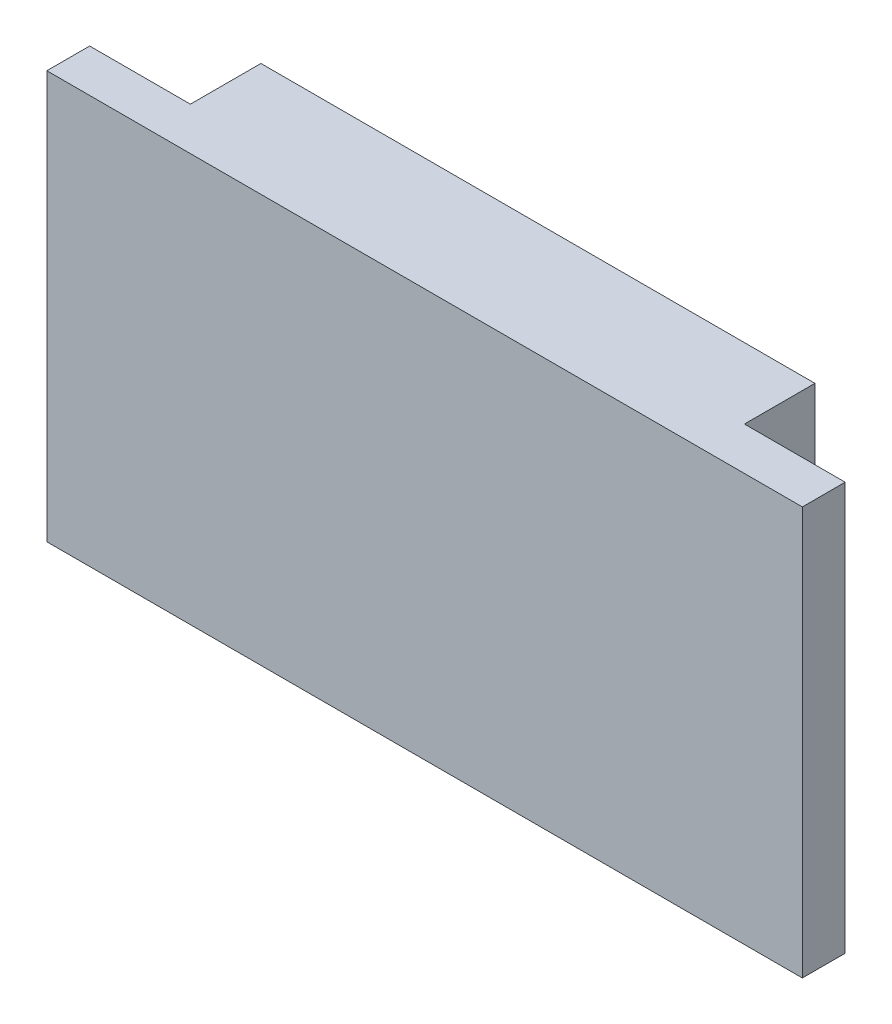
from build123d import *

# Parameters (mm, degrees)
SKETCH_1_W          = 30
SKETCH_1_H          = 16.2
EXTRUDE_1_DEPTH     = 4.5
SKETCH_2_W          = 4
SKETCH_2_H          = 16.2
CUT_EXTRUDE_1_DEPTH = 2.8


with BuildPart() as part:
    # 草图1 → 凸台-拉伸1 (new body)
    with BuildSketch(Plane.XY):
        Rectangle(SKETCH_1_W, SKETCH_1_H)
    extrude(amount=EXTRUDE_1_DEPTH)

    # 草图2 → 切除-拉伸1 (cut)
    with BuildSketch(Plane(origin=(0, 0, 0), x_dir=(-1, 0, 0), z_dir=(0, 0, -1))):
        with Locations((-13, 0)):
            Rectangle(SKETCH_2_W, SKETCH_2_H)
        with Locations((13, 0)):
            Rectangle(SKETCH_2_W, SKETCH_2_H)
    extrude(amount=-CUT_EXTRUDE_1_DEPTH, mode=Mode.SUBTRACT)


solid = part.part
